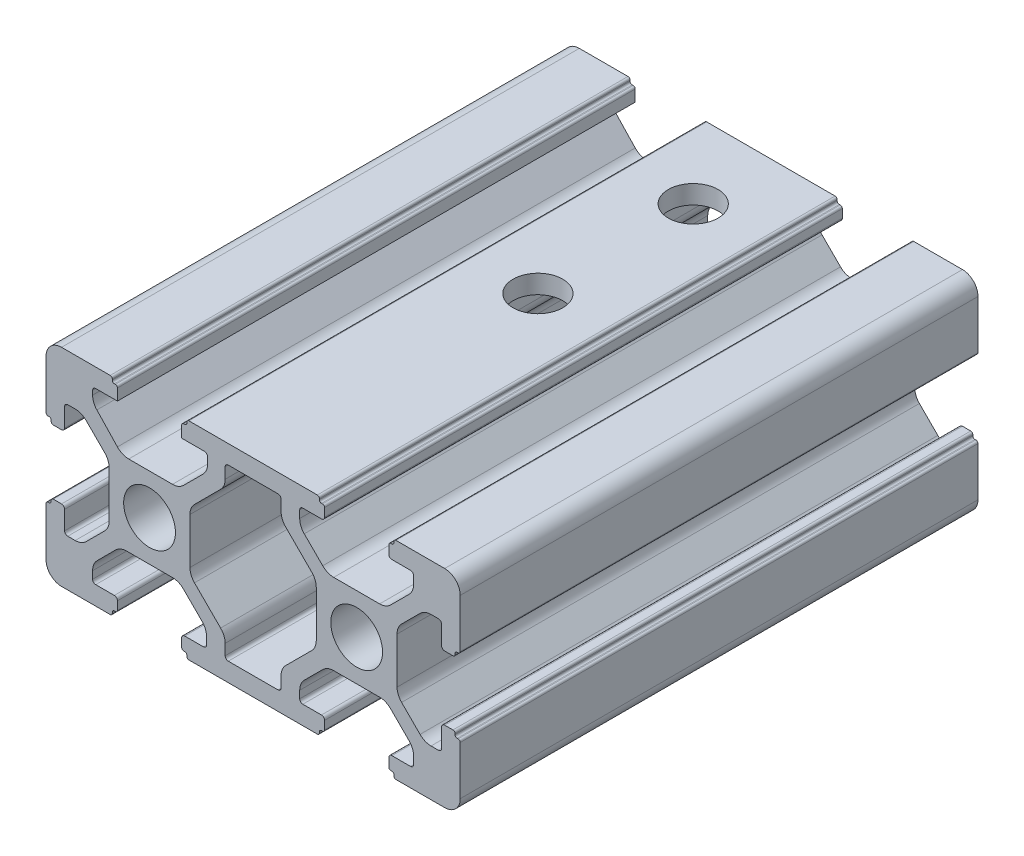
from build123d import *

# Parameters (mm, degrees)
SKETCH1_R           = 2.5
BOSS_EXTRUDE2_DEPTH = 50
SKETCH2_R           = 2.4
CUT_EXTRUDE1_DEPTH  = 39


with BuildPart() as part:
    # Sketch1 → Boss-Extrude2 (new body)
    with BuildSketch(Plane.XY):
        with BuildLine():
            Line((1.5, 0), (6.2, 0))
            ThreePointArc((6.2, 0), (6.341421356, 0.058578644), (6.4, 0.2))
            Line((6.4, 0.2), (6.4, 0.3))
            ThreePointArc((6.4, 0.3), (6.458578644, 0.441421356), (6.6, 0.5))
            Line((6.6, 0.5), (6.7, 0.5))
            ThreePointArc((6.7, 0.5), (6.841421356, 0.558578644), (6.9, 0.7))
            Line((6.9, 0.7), (6.9, 1.5))
            ThreePointArc((6.9, 1.5), (6.812132034, 1.712132034), (6.6, 1.8))
            Line((6.6, 1.8), (4.8, 1.8))
            ThreePointArc((4.8, 1.8), (4.587867966, 1.887867966), (4.5, 2.1))
            Line((4.5, 2.1), (4.5, 2.818019485))
            ThreePointArc((4.5, 2.818019485), (4.614180701, 3.392044633), (4.939339828, 3.878679656))
            Line((4.939339828, 3.878679656), (6.721320344, 5.660660172))
            ThreePointArc((6.721320344, 5.660660172), (7.207955367, 5.985819299), (7.781980515, 6.1))
            Line((7.781980515, 6.1), (12.218019485, 6.1))
            ThreePointArc((12.218019485, 6.1), (12.792044633, 5.985819299), (13.278679656, 5.660660172))
            Line((13.278679656, 5.660660172), (15.060660172, 3.878679656))
            ThreePointArc((15.060660172, 3.878679656), (15.385819299, 3.392044633), (15.5, 2.818019485))
            Line((15.5, 2.818019485), (15.5, 2.1))
            ThreePointArc((15.5, 2.1), (15.412132034, 1.887867966), (15.2, 1.8))
            Line((15.2, 1.8), (13.4, 1.8))
            ThreePointArc((13.4, 1.8), (13.187867966, 1.712132034), (13.1, 1.5))
            Line((13.1, 1.5), (13.1, 0.7))
            ThreePointArc((13.1, 0.7), (13.158578644, 0.558578644), (13.3, 0.5))
            Line((13.3, 0.5), (13.4, 0.5))
            ThreePointArc((13.4, 0.5), (13.541421356, 0.441421356), (13.6, 0.3))
            Line((13.6, 0.3), (13.6, 0.2))
            ThreePointArc((13.6, 0.2), (13.658578644, 0.058578644), (13.8, 0))
            Line((13.8, 0), (26.2, 0))
            ThreePointArc((26.2, 0), (26.341421356, 0.058578644), (26.4, 0.2))
            Line((26.4, 0.2), (26.4, 0.3))
            ThreePointArc((26.4, 0.3), (26.458578644, 0.441421356), (26.6, 0.5))
            Line((26.6, 0.5), (26.7, 0.5))
            ThreePointArc((26.7, 0.5), (26.841421356, 0.558578644), (26.9, 0.7))
            Line((26.9, 0.7), (26.9, 1.5))
            ThreePointArc((26.9, 1.5), (26.812132034, 1.712132034), (26.6, 1.8))
            Line((26.6, 1.8), (24.8, 1.8))
            ThreePointArc((24.8, 1.8), (24.587867966, 1.887867966), (24.5, 2.1))
            Line((24.5, 2.1), (24.5, 2.818019485))
            ThreePointArc((24.5, 2.818019485), (24.614180701, 3.392044633), (24.939339828, 3.878679656))
            Line((24.939339828, 3.878679656), (26.721320344, 5.660660172))
            ThreePointArc((26.721320344, 5.660660172), (27.207955367, 5.985819299), (27.781980515, 6.1))
            Line((27.781980515, 6.1), (32.218019485, 6.1))
            ThreePointArc((32.218019485, 6.1), (32.792044633, 5.985819299), (33.278679656, 5.660660172))
            Line((33.278679656, 5.660660172), (35.060660172, 3.878679656))
            ThreePointArc((35.060660172, 3.878679656), (35.385819299, 3.392044633), (35.5, 2.818019485))
            Line((35.5, 2.818019485), (35.5, 2.1))
            ThreePointArc((35.5, 2.1), (35.412132034, 1.887867966), (35.2, 1.8))
            Line((35.2, 1.8), (33.4, 1.8))
            ThreePointArc((33.4, 1.8), (33.187867966, 1.712132034), (33.1, 1.5))
            Line((33.1, 1.5), (33.1, 0.7))
            ThreePointArc((33.1, 0.7), (33.158578644, 0.558578644), (33.3, 0.5))
            Line((33.3, 0.5), (33.4, 0.5))
            ThreePointArc((33.4, 0.5), (33.541421356, 0.441421356), (33.6, 0.3))
            Line((33.6, 0.3), (33.6, 0.2))
            ThreePointArc((33.6, 0.2), (33.658578644, 0.058578644), (33.8, 0))
            Line((33.8, 0), (38.5, 0))
            ThreePointArc((38.5, 0), (39.560660172, 0.439339828), (40, 1.5))
            Line((40, 1.5), (40, 6.2))
            ThreePointArc((40, 6.2), (39.941421356, 6.341421356), (39.8, 6.4))
            Line((39.8, 6.4), (39.7, 6.4))
            ThreePointArc((39.7, 6.4), (39.558578644, 6.458578644), (39.5, 6.6))
            Line((39.5, 6.6), (39.5, 6.7))
            ThreePointArc((39.5, 6.7), (39.441421356, 6.841421356), (39.3, 6.9))
            Line((39.3, 6.9), (38.5, 6.9))
            ThreePointArc((38.5, 6.9), (38.287867966, 6.812132034), (38.2, 6.6))
            Line((38.2, 6.6), (38.2, 4.8))
            ThreePointArc((38.2, 4.8), (38.112132034, 4.587867966), (37.9, 4.5))
            Line((37.9, 4.5), (37.181980515, 4.5))
            ThreePointArc((37.181980515, 4.5), (36.607955367, 4.614180701), (36.121320344, 4.939339828))
            Line((36.121320344, 4.939339828), (34.339339828, 6.721320344))
            ThreePointArc((34.339339828, 6.721320344), (34.014180701, 7.207955367), (33.9, 7.781980515))
            Line((33.9, 7.781980515), (33.9, 12.218019485))
            ThreePointArc((33.9, 12.218019485), (34.014180701, 12.792044633), (34.339339828, 13.278679656))
            Line((34.339339828, 13.278679656), (36.121320344, 15.060660172))
            ThreePointArc((36.121320344, 15.060660172), (36.607955367, 15.385819299), (37.181980515, 15.5))
            Line((37.181980515, 15.5), (37.9, 15.5))
            ThreePointArc((37.9, 15.5), (38.112132034, 15.412132034), (38.2, 15.2))
            Line((38.2, 15.2), (38.2, 13.4))
            ThreePointArc((38.2, 13.4), (38.287867966, 13.187867966), (38.5, 13.1))
            Line((38.5, 13.1), (39.3, 13.1))
            ThreePointArc((39.3, 13.1), (39.441421356, 13.158578644), (39.5, 13.3))
            Line((39.5, 13.3), (39.5, 13.4))
            ThreePointArc((39.5, 13.4), (39.558578644, 13.541421356), (39.7, 13.6))
            Line((39.7, 13.6), (39.8, 13.6))
            ThreePointArc((39.8, 13.6), (39.941421356, 13.658578644), (40, 13.8))
            Line((40, 13.8), (40, 18.5))
            ThreePointArc((40, 18.5), (39.560660172, 19.560660172), (38.5, 20))
            Line((38.5, 20), (33.8, 20))
            ThreePointArc((33.8, 20), (33.658578644, 19.941421356), (33.6, 19.8))
            Line((33.6, 19.8), (33.6, 19.7))
            ThreePointArc((33.6, 19.7), (33.541421356, 19.558578644), (33.4, 19.5))
            Line((33.4, 19.5), (33.3, 19.5))
            ThreePointArc((33.3, 19.5), (33.158578644, 19.441421356), (33.1, 19.3))
            Line((33.1, 19.3), (33.1, 18.5))
            ThreePointArc((33.1, 18.5), (33.187867966, 18.287867966), (33.4, 18.2))
            Line((33.4, 18.2), (35.2, 18.2))
            ThreePointArc((35.2, 18.2), (35.412132034, 18.112132034), (35.5, 17.9))
            Line((35.5, 17.9), (35.5, 17.181980515))
            ThreePointArc((35.5, 17.181980515), (35.385819299, 16.607955367), (35.060660172, 16.121320344))
            Line((35.060660172, 16.121320344), (33.278679656, 14.339339828))
            ThreePointArc((33.278679656, 14.339339828), (32.792044633, 14.014180701), (32.218019485, 13.9))
            Line((32.218019485, 13.9), (27.781980515, 13.9))
            ThreePointArc((27.781980515, 13.9), (27.207955367, 14.014180701), (26.721320344, 14.339339828))
            Line((26.721320344, 14.339339828), (24.939339828, 16.121320344))
            ThreePointArc((24.939339828, 16.121320344), (24.614180701, 16.607955367), (24.5, 17.181980515))
            Line((24.5, 17.181980515), (24.5, 17.9))
            ThreePointArc((24.5, 17.9), (24.587867966, 18.112132034), (24.8, 18.2))
            Line((24.8, 18.2), (26.6, 18.2))
            ThreePointArc((26.6, 18.2), (26.812132034, 18.287867966), (26.9, 18.5))
            Line((26.9, 18.5), (26.9, 19.3))
            ThreePointArc((26.9, 19.3), (26.841421356, 19.441421356), (26.7, 19.5))
            Line((26.7, 19.5), (26.6, 19.5))
            ThreePointArc((26.6, 19.5), (26.458578644, 19.558578644), (26.4, 19.7))
            Line((26.4, 19.7), (26.4, 19.8))
            ThreePointArc((26.4, 19.8), (26.341421356, 19.941421356), (26.2, 20))
            Line((26.2, 20), (13.8, 20))
            ThreePointArc((13.8, 20), (13.658578644, 19.941421356), (13.6, 19.8))
            Line((13.6, 19.8), (13.6, 19.7))
            ThreePointArc((13.6, 19.7), (13.541421356, 19.558578644), (13.4, 19.5))
            Line((13.4, 19.5), (13.3, 19.5))
            ThreePointArc((13.3, 19.5), (13.158578644, 19.441421356), (13.1, 19.3))
            Line((13.1, 19.3), (13.1, 18.2))
            Line((13.1, 18.2), (15.3, 18.2))
            ThreePointArc((15.3, 18.2), (15.512132034, 18.112132034), (15.6, 17.9))
            Line((15.6, 17.9), (15.6, 17.281980515))
            ThreePointArc((15.6, 17.281980515), (15.485819299, 16.707955367), (15.160660172, 16.221320344))
            Line((15.160660172, 16.221320344), (13.278679656, 14.339339828))
            ThreePointArc((13.278679656, 14.339339828), (12.792044633, 14.014180701), (12.218019485, 13.9))
            Line((12.218019485, 13.9), (7.986375635, 13.9))
            ThreePointArc((7.986375635, 13.9), (7.393381044, 14.022191082), (6.896997987, 14.36885678))
            Line((6.896997987, 14.36885678), (4.910622352, 16.467414163))
            ThreePointArc((4.910622352, 16.467414163), (4.606431474, 16.943609851), (4.5, 17.498557383))
            Line((4.5, 17.498557383), (4.5, 17.9))
            ThreePointArc((4.5, 17.9), (4.587867966, 18.112132034), (4.8, 18.2))
            Line((4.8, 18.2), (6.9, 18.2))
            Line((6.9, 18.2), (6.9, 19.3))
            ThreePointArc((6.9, 19.3), (6.841421356, 19.441421356), (6.7, 19.5))
            Line((6.7, 19.5), (6.6, 19.5))
            ThreePointArc((6.6, 19.5), (6.458578644, 19.558578644), (6.4, 19.7))
            Line((6.4, 19.7), (6.4, 19.8))
            ThreePointArc((6.4, 19.8), (6.341421356, 19.941421356), (6.2, 20))
            Line((6.2, 20), (1.5, 20))
            ThreePointArc((1.5, 20), (0.439339828, 19.560660172), (0, 18.5))
            Line((0, 18.5), (0, 13.8))
            ThreePointArc((0, 13.8), (0.058578644, 13.658578644), (0.2, 13.6))
            Line((0.2, 13.6), (0.3, 13.6))
            ThreePointArc((0.3, 13.6), (0.441421356, 13.541421356), (0.5, 13.4))
            Line((0.5, 13.4), (0.5, 13.3))
            ThreePointArc((0.5, 13.3), (0.558578644, 13.158578644), (0.7, 13.1))
            Line((0.7, 13.1), (1.5, 13.1))
            ThreePointArc((1.5, 13.1), (1.712132034, 13.187867966), (1.8, 13.4))
            Line((1.8, 13.4), (1.8, 15.2))
            ThreePointArc((1.8, 15.2), (1.887867966, 15.412132034), (2.1, 15.5))
            Line((2.1, 15.5), (2.818019485, 15.5))
            ThreePointArc((2.818019485, 15.5), (3.392044633, 15.385819299), (3.878679656, 15.060660172))
            Line((3.878679656, 15.060660172), (5.660660172, 13.278679656))
            ThreePointArc((5.660660172, 13.278679656), (5.985819299, 12.792044633), (6.1, 12.218019485))
            Line((6.1, 12.218019485), (6.1, 7.781980515))
            ThreePointArc((6.1, 7.781980515), (5.985819299, 7.207955367), (5.660660172, 6.721320344))
            Line((5.660660172, 6.721320344), (3.878679656, 4.939339828))
            ThreePointArc((3.878679656, 4.939339828), (3.392044633, 4.614180701), (2.818019485, 4.5))
            Line((2.818019485, 4.5), (2.1, 4.5))
            ThreePointArc((2.1, 4.5), (1.887867966, 4.587867966), (1.8, 4.8))
            Line((1.8, 4.8), (1.8, 6.6))
            ThreePointArc((1.8, 6.6), (1.712132034, 6.812132034), (1.5, 6.9))
            Line((1.5, 6.9), (0.7, 6.9))
            ThreePointArc((0.7, 6.9), (0.558578644, 6.841421356), (0.5, 6.7))
            Line((0.5, 6.7), (0.5, 6.6))
            ThreePointArc((0.5, 6.6), (0.441421356, 6.458578644), (0.3, 6.4))
            Line((0.3, 6.4), (0.2, 6.4))
            ThreePointArc((0.2, 6.4), (0.058578644, 6.341421356), (0, 6.2))
            Line((0, 6.2), (0, 1.5))
            ThreePointArc((0, 1.5), (0.439339828, 0.439339828), (1.5, 0))
        make_face()
        with Locations((10, 10)):
            Circle(SKETCH1_R, mode=Mode.SUBTRACT)
        with Locations((30, 10)):
            Circle(SKETCH1_R, mode=Mode.SUBTRACT)
        with BuildLine():
            Line((17.6, 1.8), (22.4, 1.8))
            ThreePointArc((22.4, 1.8), (22.612132034, 1.887867966), (22.7, 2.1))
            Line((22.7, 2.1), (22.7, 3.139339828))
            ThreePointArc((22.7, 3.139339828), (22.814180701, 3.713364977), (23.139339828, 4.2))
            Line((23.139339828, 4.2), (25.660660172, 6.721320344))
            ThreePointArc((25.660660172, 6.721320344), (25.985819299, 7.207955367), (26.1, 7.781980515))
            Line((26.1, 7.781980515), (26.1, 12.218019485))
            ThreePointArc((26.1, 12.218019485), (25.985819299, 12.792044633), (25.660660172, 13.278679656))
            Line((25.660660172, 13.278679656), (23.139339828, 15.8))
            ThreePointArc((23.139339828, 15.8), (22.814180701, 16.286635023), (22.7, 16.860660172))
            Line((22.7, 16.860660172), (22.7, 17.9))
            ThreePointArc((22.7, 17.9), (22.612132034, 18.112132034), (22.4, 18.2))
            Line((22.4, 18.2), (17.6, 18.2))
            ThreePointArc((17.6, 18.2), (17.387867966, 18.112132034), (17.3, 17.9))
            Line((17.3, 17.9), (17.3, 16.860660172))
            ThreePointArc((17.3, 16.860660172), (17.185819299, 16.286635023), (16.860660172, 15.8))
            Line((16.860660172, 15.8), (14.339339828, 13.278679656))
            ThreePointArc((14.339339828, 13.278679656), (14.014180701, 12.792044633), (13.9, 12.218019485))
            Line((13.9, 12.218019485), (13.9, 7.781980515))
            ThreePointArc((13.9, 7.781980515), (14.014180701, 7.207955367), (14.339339828, 6.721320344))
            Line((14.339339828, 6.721320344), (16.860660172, 4.2))
            ThreePointArc((16.860660172, 4.2), (17.185819299, 3.713364977), (17.3, 3.139339828))
            Line((17.3, 3.139339828), (17.3, 2.1))
            ThreePointArc((17.3, 2.1), (17.387867966, 1.887867966), (17.6, 1.8))
        make_face(mode=Mode.SUBTRACT)
    extrude(amount=BOSS_EXTRUDE2_DEPTH)

    # Sketch2 → Cut-Extrude1 (cut)
    with BuildSketch(Plane(origin=(0, 20, 0), x_dir=(1, 0, 0), z_dir=(0, 1, 0))):
        with Locations(Location((20, -7.5, 0), (0, 0, 180))):
            Circle(SKETCH2_R)
        with Locations(Location((20, -22.5, 0), (0, 0, 180))):
            Circle(SKETCH2_R)
    extrude(amount=-CUT_EXTRUDE1_DEPTH, mode=Mode.SUBTRACT)


solid = part.part
